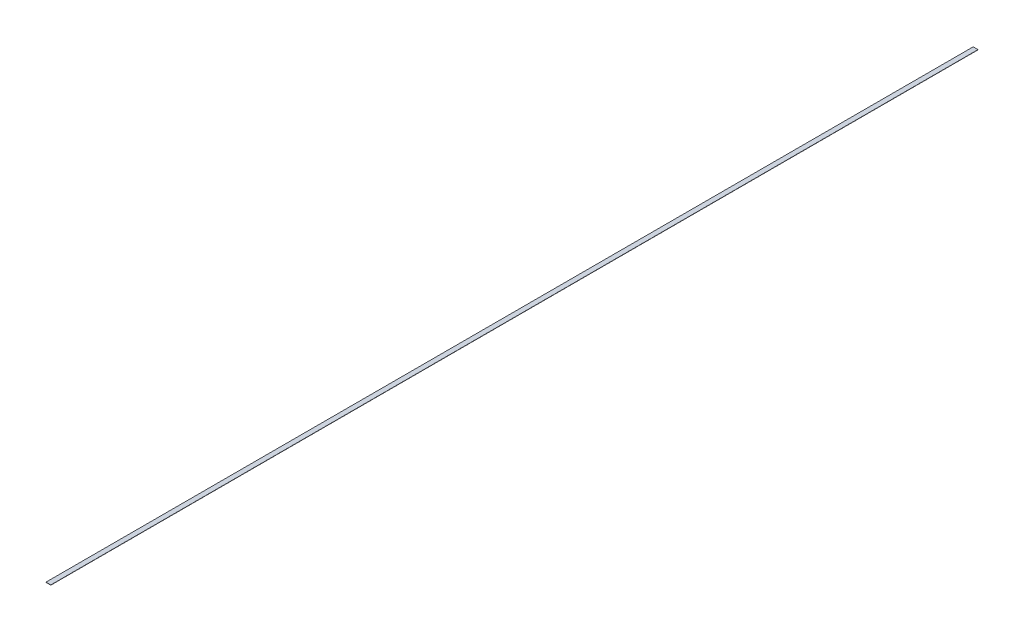
from build123d import *

# Parameters (mm, degrees)
SKETCH2_W           = 50.8
SKETCH2_H           = 9753.6
BOSS_EXTRUDE1_DEPTH = 2.54


with BuildPart() as part:
    # Sketch2 → Boss-Extrude1 (new body)
    with BuildSketch(Plane(origin=(0, 0, 0), x_dir=(1, 0, 0), z_dir=(0, 1, 0))):
        Rectangle(SKETCH2_W, SKETCH2_H)
    extrude(amount=BOSS_EXTRUDE1_DEPTH)


solid = part.part
